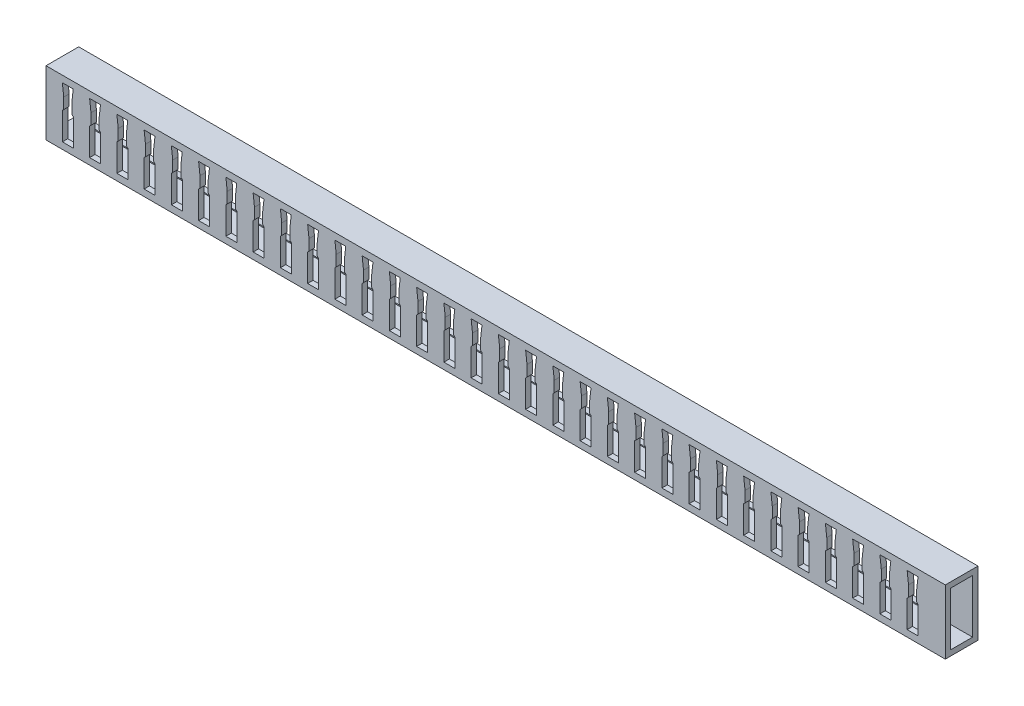
from build123d import *

# Parameters (mm, degrees)
SKETCH2_W           = 15.24
SKETCH2_H           = 29.972
BOSS_EXTRUDE1_DEPTH = 419.1
SKETCH3_W           = 10.16
SKETCH3_H           = 24.892
CUT_EXTRUDE1_DEPTH  = 419.1
CUT_EXTRUDE2_DEPTH  = 419.1


with BuildPart() as part:
    # Sketch2 → Boss-Extrude1 (new body)
    with BuildSketch(Plane(origin=(0, 0, 0), x_dir=(0, 0, -1), z_dir=(1, 0, 0))):
        with Locations((7.62, 14.986)):
            Rectangle(SKETCH2_W, SKETCH2_H)
    extrude(amount=BOSS_EXTRUDE1_DEPTH)

    # Sketch3 → Cut-Extrude1 (cut)
    with BuildSketch(Plane(origin=(419.1, 0, 0), x_dir=(0, 0, -1), z_dir=(1, 0, 0))):
        with Locations((7.62, 14.986)):
            Rectangle(SKETCH3_W, SKETCH3_H)
    extrude(amount=-CUT_EXTRUDE1_DEPTH, mode=Mode.SUBTRACT)

    # Sketch4 → Cut-Extrude2 (cut)
    with BuildSketch(Plane.XY):
        Polygon((7.62, 3.048), (7.62, 15.748), (8.255, 16.383), (8.255, 21.463), (7.62, 26.924), (12.7, 26.924), (12.065, 21.463), (12.065, 16.383), (12.7, 15.748), (12.7, 3.048), align=None)
        Polygon((25.4, 3.048), (20.32, 3.048), (20.32, 15.748), (20.955, 16.383), (20.955, 21.463), (20.32, 26.924), (25.4, 26.924), (24.765, 21.463), (24.765, 16.383), (25.4, 15.748), align=None)
        Polygon((38.1, 3.048), (33.02, 3.048), (33.02, 15.748), (33.655, 16.383), (33.655, 21.463), (33.02, 26.924), (38.1, 26.924), (37.465, 21.463), (37.465, 16.383), (38.1, 15.748), align=None)
        Polygon((50.8, 3.048), (45.72, 3.048), (45.72, 15.748), (46.355, 16.383), (46.355, 21.463), (45.72, 26.924), (50.8, 26.924), (50.165, 21.463), (50.165, 16.383), (50.8, 15.748), align=None)
        Polygon((63.5, 3.048), (58.42, 3.048), (58.42, 15.748), (59.055, 16.383), (59.055, 21.463), (58.42, 26.924), (63.5, 26.924), (62.865, 21.463), (62.865, 16.383), (63.5, 15.748), align=None)
        Polygon((76.2, 3.048), (71.12, 3.048), (71.12, 15.748), (71.755, 16.383), (71.755, 21.463), (71.12, 26.924), (76.2, 26.924), (75.565, 21.463), (75.565, 16.383), (76.2, 15.748), align=None)
        Polygon((88.9, 3.048), (83.82, 3.048), (83.82, 15.748), (84.455, 16.383), (84.455, 21.463), (83.82, 26.924), (88.9, 26.924), (88.265, 21.463), (88.265, 16.383), (88.9, 15.748), align=None)
        Polygon((101.6, 3.048), (96.52, 3.048), (96.52, 15.748), (97.155, 16.383), (97.155, 21.463), (96.52, 26.924), (101.6, 26.924), (100.965, 21.463), (100.965, 16.383), (101.6, 15.748), align=None)
        Polygon((114.3, 3.048), (109.22, 3.048), (109.22, 15.748), (109.855, 16.383), (109.855, 21.463), (109.22, 26.924), (114.3, 26.924), (113.665, 21.463), (113.665, 16.383), (114.3, 15.748), align=None)
        Polygon((127, 3.048), (121.92, 3.048), (121.92, 15.748), (122.555, 16.383), (122.555, 21.463), (121.92, 26.924), (127, 26.924), (126.365, 21.463), (126.365, 16.383), (127, 15.748), align=None)
        Polygon((139.7, 3.048), (134.62, 3.048), (134.62, 15.748), (135.255, 16.383), (135.255, 21.463), (134.62, 26.924), (139.7, 26.924), (139.065, 21.463), (139.065, 16.383), (139.7, 15.748), align=None)
        Polygon((152.4, 3.048), (147.32, 3.048), (147.32, 15.748), (147.955, 16.383), (147.955, 21.463), (147.32, 26.924), (152.4, 26.924), (151.765, 21.463), (151.765, 16.383), (152.4, 15.748), align=None)
        Polygon((165.1, 3.048), (160.02, 3.048), (160.02, 15.748), (160.655, 16.383), (160.655, 21.463), (160.02, 26.924), (165.1, 26.924), (164.465, 21.463), (164.465, 16.383), (165.1, 15.748), align=None)
        Polygon((177.8, 3.048), (172.72, 3.048), (172.72, 15.748), (173.355, 16.383), (173.355, 21.463), (172.72, 26.924), (177.8, 26.924), (177.165, 21.463), (177.165, 16.383), (177.8, 15.748), align=None)
        Polygon((190.5, 3.048), (185.42, 3.048), (185.42, 15.748), (186.055, 16.383), (186.055, 21.463), (185.42, 26.924), (190.5, 26.924), (189.865, 21.463), (189.865, 16.383), (190.5, 15.748), align=None)
        Polygon((203.2, 3.048), (198.12, 3.048), (198.12, 15.748), (198.755, 16.383), (198.755, 21.463), (198.12, 26.924), (203.2, 26.924), (202.565, 21.463), (202.565, 16.383), (203.2, 15.748), align=None)
        Polygon((215.9, 3.048), (210.82, 3.048), (210.82, 15.748), (211.455, 16.383), (211.455, 21.463), (210.82, 26.924), (215.9, 26.924), (215.265, 21.463), (215.265, 16.383), (215.9, 15.748), align=None)
        Polygon((228.6, 3.048), (223.52, 3.048), (223.52, 15.748), (224.155, 16.383), (224.155, 21.463), (223.52, 26.924), (228.6, 26.924), (227.965, 21.463), (227.965, 16.383), (228.6, 15.748), align=None)
        Polygon((241.3, 3.048), (236.22, 3.048), (236.22, 15.748), (236.855, 16.383), (236.855, 21.463), (236.22, 26.924), (241.3, 26.924), (240.665, 21.463), (240.665, 16.383), (241.3, 15.748), align=None)
        Polygon((254, 3.048), (248.92, 3.048), (248.92, 15.748), (249.555, 16.383), (249.555, 21.463), (248.92, 26.924), (254, 26.924), (253.365, 21.463), (253.365, 16.383), (254, 15.748), align=None)
        Polygon((266.7, 3.048), (261.62, 3.048), (261.62, 15.748), (262.255, 16.383), (262.255, 21.463), (261.62, 26.924), (266.7, 26.924), (266.065, 21.463), (266.065, 16.383), (266.7, 15.748), align=None)
        Polygon((279.4, 3.048), (274.32, 3.048), (274.32, 15.748), (274.955, 16.383), (274.955, 21.463), (274.32, 26.924), (279.4, 26.924), (278.765, 21.463), (278.765, 16.383), (279.4, 15.748), align=None)
        Polygon((292.1, 3.048), (287.02, 3.048), (287.02, 15.748), (287.655, 16.383), (287.655, 21.463), (287.02, 26.924), (292.1, 26.924), (291.465, 21.463), (291.465, 16.383), (292.1, 15.748), align=None)
        Polygon((304.8, 3.048), (299.72, 3.048), (299.72, 15.748), (300.355, 16.383), (300.355, 21.463), (299.72, 26.924), (304.8, 26.924), (304.165, 21.463), (304.165, 16.383), (304.8, 15.748), align=None)
        Polygon((317.5, 3.048), (312.42, 3.048), (312.42, 15.748), (313.055, 16.383), (313.055, 21.463), (312.42, 26.924), (317.5, 26.924), (316.865, 21.463), (316.865, 16.383), (317.5, 15.748), align=None)
        Polygon((330.2, 3.048), (325.12, 3.048), (325.12, 15.748), (325.755, 16.383), (325.755, 21.463), (325.12, 26.924), (330.2, 26.924), (329.565, 21.463), (329.565, 16.383), (330.2, 15.748), align=None)
        Polygon((342.9, 3.048), (337.82, 3.048), (337.82, 15.748), (338.455, 16.383), (338.455, 21.463), (337.82, 26.924), (342.9, 26.924), (342.265, 21.463), (342.265, 16.383), (342.9, 15.748), align=None)
        Polygon((355.6, 3.048), (350.52, 3.048), (350.52, 15.748), (351.155, 16.383), (351.155, 21.463), (350.52, 26.924), (355.6, 26.924), (354.965, 21.463), (354.965, 16.383), (355.6, 15.748), align=None)
        Polygon((368.3, 3.048), (363.22, 3.048), (363.22, 15.748), (363.855, 16.383), (363.855, 21.463), (363.22, 26.924), (368.3, 26.924), (367.665, 21.463), (367.665, 16.383), (368.3, 15.748), align=None)
        Polygon((381, 3.048), (375.92, 3.048), (375.92, 15.748), (376.555, 16.383), (376.555, 21.463), (375.92, 26.924), (381, 26.924), (380.365, 21.463), (380.365, 16.383), (381, 15.748), align=None)
        Polygon((393.7, 3.048), (388.62, 3.048), (388.62, 15.748), (389.255, 16.383), (389.255, 21.463), (388.62, 26.924), (393.7, 26.924), (393.065, 21.463), (393.065, 16.383), (393.7, 15.748), align=None)
        Polygon((406.4, 3.048), (401.32, 3.048), (401.32, 15.748), (401.955, 16.383), (401.955, 21.463), (401.32, 26.924), (406.4, 26.924), (405.765, 21.463), (405.765, 16.383), (406.4, 15.748), align=None)
    extrude(amount=-CUT_EXTRUDE2_DEPTH, mode=Mode.SUBTRACT)


solid = part.part
